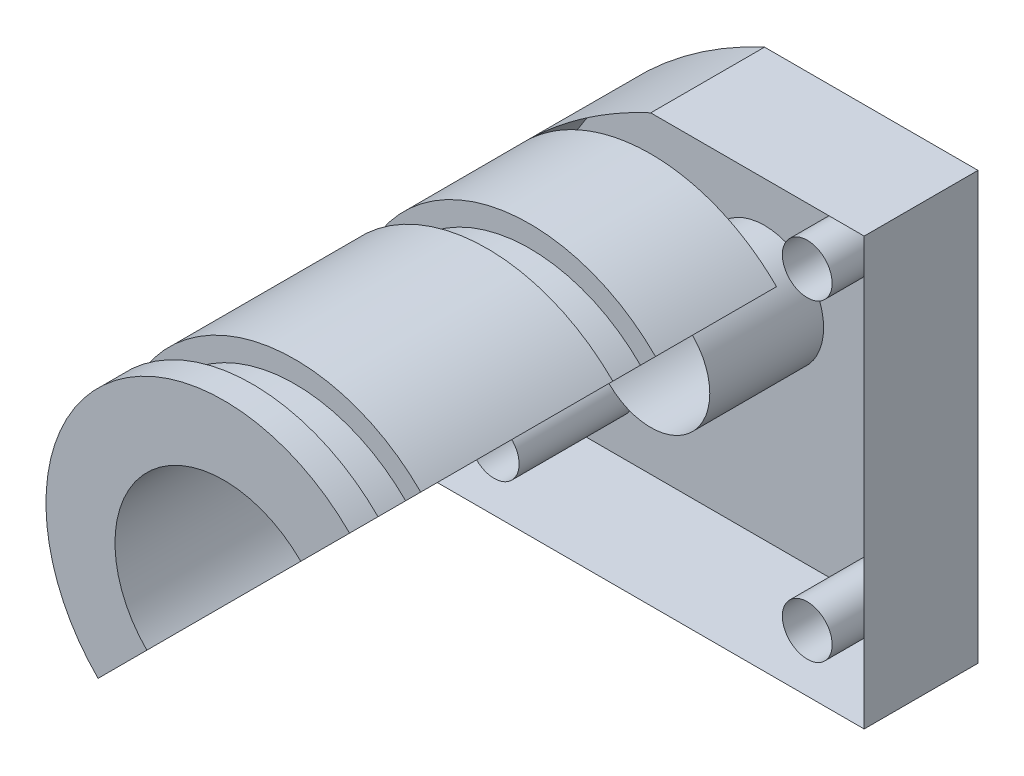
from build123d import *

# Parameters (mm, degrees)
IZIM1_W                     = 30
IZIM1_H                     = 30
Y_KSEKLIK_EKSTR_ZYON1_DEPTH = 8
IZIM3_R                     = 1.75
KES_EKSTR_ZYON1_DEPTH       = 30
Y_KSEKLIK_EKSTR_ZYON3_DEPTH = 30
KES_EKSTR_ZYON2_DEPTH       = 30
IZIM5_R                     = 4.15
KES_EKSTR_ZYON3_DEPTH       = 30
IZIM6_W                     = 3
IZIM6_H                     = 1.5


with BuildPart() as part:
    # Çizim1 → Yükseklik-Ekstrüzyon1 (new body)
    with BuildSketch(Plane.XY):
        with Locations((15, 15)):
            Rectangle(IZIM1_W, IZIM1_H)
    extrude(amount=Y_KSEKLIK_EKSTR_ZYON1_DEPTH)

    # Çizim3 → Kes-Ekstrüzyon1 (cut)
    with BuildSketch(Plane.XY.offset(8)):
        with Locations((4, 26)):
            Circle(IZIM3_R)
        with Locations((4, 4)):
            Circle(IZIM3_R)
        with Locations((26, 26)):
            Circle(IZIM3_R)
        with Locations((26, 4)):
            Circle(IZIM3_R)
    extrude(amount=-KES_EKSTR_ZYON1_DEPTH, mode=Mode.SUBTRACT)

    # Çizim2 → Yükseklik-Ekstrüzyon3 (add)
    with BuildSketch(Plane.XY.offset(8)):
        with BuildLine():
            Line((6.161165235, 6.161165235), (9.590633124, 9.590633124))
            ThreePointArc((9.590633124, 9.590633124), (9.590633124, 20.409366876), (20.409366876, 20.409366876))
            Line((20.409366876, 20.409366876), (23.838834765, 23.838834765))
            ThreePointArc((23.838834765, 23.838834765), (6.161165235, 23.838834765), (6.161165235, 6.161165235))
        make_face()
    extrude(amount=Y_KSEKLIK_EKSTR_ZYON3_DEPTH)

    # Çizim4 → Kes-Ekstrüzyon2 (cut)
    with BuildSketch(Plane.XY.offset(8)):
        with BuildLine():
            Line((0, 15), (0, 30))
            Line((0, 30), (15, 30))
            ThreePointArc((15, 30), (6.161165235, 23.838834765), (0, 15))
        make_face()
    extrude(amount=-KES_EKSTR_ZYON2_DEPTH, mode=Mode.SUBTRACT)

    # Çizim5 → Kes-Ekstrüzyon3 (cut)
    with BuildSketch(Plane.XY.offset(8)):
        with Locations((15, 15)):
            Circle(IZIM5_R)
    extrude(amount=-KES_EKSTR_ZYON3_DEPTH, mode=Mode.SUBTRACT)

    # Çizim6 → Kes-Döndür1 (revolve, cut)
    with BuildSketch(Plane(origin=(0, 0, 0), x_dir=(0, 0, -1), z_dir=(0.7071067811865472, -0.7071067811865478, 0))):
        with Locations((-34.5, 32.963203436)):
            Rectangle(IZIM6_W, IZIM6_H)
        with Locations((-18, 32.963203436)):
            Rectangle(IZIM6_W, IZIM6_H)
    revolve(axis=Axis((15, 15, 42.321242124), (0, 0, -1)), mode=Mode.SUBTRACT)


solid = part.part
